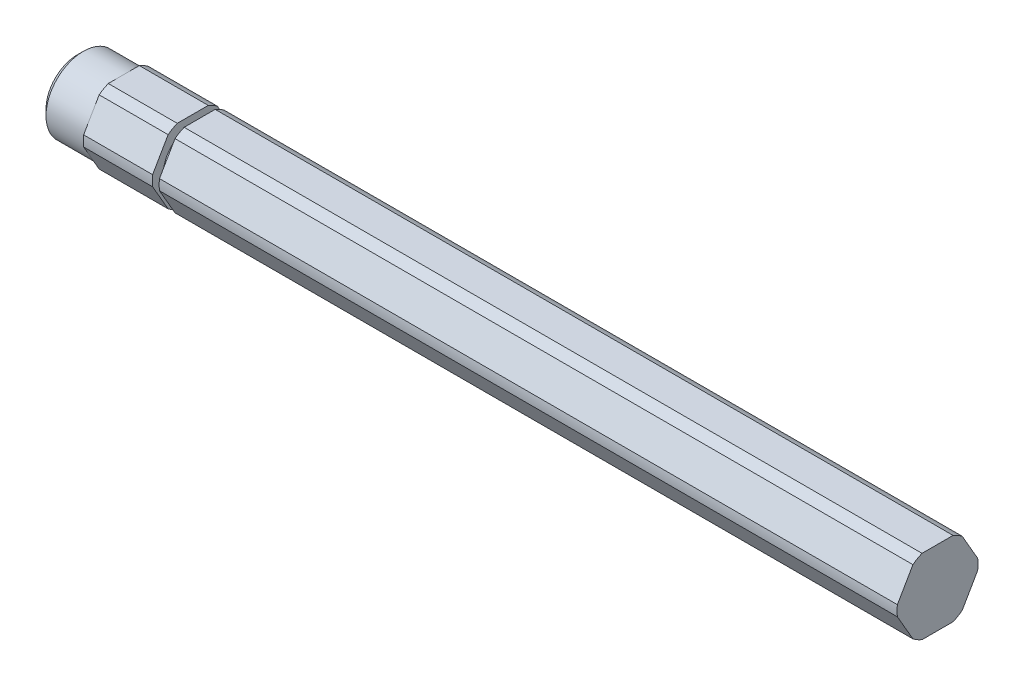
from build123d import *

# Parameters (mm, degrees)
BOSS_EXTRUDE1_DEPTH = 73.025
CUT_EXTRUDE1_START  = -7.8867
SKETCH2_R           = 6.3373
CUT_EXTRUDE1_DEPTH  = 7.8867
CUT_EXTRUDE2_START  = -1.1684
SKETCH3_R           = 5.0292
CUT_EXTRUDE2_DEPTH  = 1.1684
SKETCH4_R           = 3.175
CUT_EXTRUDE3_DEPTH  = 9.02462
CHAMFER1_SIZE       = 1.016


with BuildPart() as part:
    # Sketch1 → Boss-Extrude1 (new, symmetric)
    with BuildSketch(Plane(origin=(0, 0, 0), x_dir=(0, 0, -1), z_dir=(1, 0, 0))):
        with BuildLine():
            Line((2.634981025, 6.35), (-2.634981025, 6.35))
            ThreePointArc((-2.634981025, 6.35), (-3.4375, 5.953924651), (-4.181770802, 5.456960506))
            Line((-4.181770802, 5.456960506), (-6.816751826, 0.893039494))
            ThreePointArc((-6.816751826, 0.893039494), (-6.875, 0), (-6.816751826, -0.893039494))
            Line((-6.816751826, -0.893039494), (-4.181770802, -5.456960506))
            ThreePointArc((-4.181770802, -5.456960506), (-3.4375, -5.953924651), (-2.634981025, -6.35))
            Line((-2.634981025, -6.35), (2.634981025, -6.35))
            ThreePointArc((2.634981025, -6.35), (3.4375, -5.953924651), (4.181770802, -5.456960506))
            Line((4.181770802, -5.456960506), (6.816751826, -0.893039494))
            ThreePointArc((6.816751826, -0.893039494), (6.875, 0), (6.816751826, 0.893039494))
            Line((6.816751826, 0.893039494), (4.181770802, 5.456960506))
            ThreePointArc((4.181770802, 5.456960506), (3.4375, 5.953924651), (2.634981025, 6.35))
        make_face()
    extrude(amount=BOSS_EXTRUDE1_DEPTH, both=True)

    # Sketch2 → Cut-Extrude1 (cut)
    with BuildSketch(Plane.ZY.offset(73.025).offset(CUT_EXTRUDE1_START)):
        with BuildLine():
            Line((-4.181770802, 5.456960506), (-6.816751826, 0.893039494))
            ThreePointArc((-6.816751826, 0.893039494), (-6.875, 0), (-6.816751826, -0.893039494))
            Line((-6.816751826, -0.893039494), (-4.181770802, -5.456960506))
            ThreePointArc((-4.181770802, -5.456960506), (-3.4375, -5.953924651), (-2.634981025, -6.35))
            Line((-2.634981025, -6.35), (2.634981025, -6.35))
            ThreePointArc((2.634981025, -6.35), (3.4375, -5.953924651), (4.181770802, -5.456960506))
            Line((4.181770802, -5.456960506), (6.816751826, -0.893039494))
            ThreePointArc((6.816751826, -0.893039494), (6.875, 0), (6.816751826, 0.893039494))
            Line((6.816751826, 0.893039494), (4.181770802, 5.456960506))
            ThreePointArc((4.181770802, 5.456960506), (3.4375, 5.953924651), (2.634981025, 6.35))
            Line((2.634981025, 6.35), (-2.634981025, 6.35))
            ThreePointArc((-2.634981025, 6.35), (-3.4375, 5.953924651), (-4.181770802, 5.456960506))
        make_face()
        Circle(SKETCH2_R, mode=Mode.SUBTRACT)
    extrude(amount=CUT_EXTRUDE1_DEPTH, mode=Mode.SUBTRACT)

    # Sketch3 → Cut-Extrude2 (cut)
    with BuildSketch(Plane.ZY.offset(53.4289).offset(CUT_EXTRUDE2_START)):
        with BuildLine():
            Line((-4.181770802, 5.456960506), (-6.816751826, 0.893039494))
            ThreePointArc((-6.816751826, 0.893039494), (-6.875, 0), (-6.816751826, -0.893039494))
            Line((-6.816751826, -0.893039494), (-4.181770802, -5.456960506))
            ThreePointArc((-4.181770802, -5.456960506), (-3.4375, -5.953924651), (-2.634981025, -6.35))
            Line((-2.634981025, -6.35), (2.634981025, -6.35))
            ThreePointArc((2.634981025, -6.35), (3.4375, -5.953924651), (4.181770802, -5.456960506))
            Line((4.181770802, -5.456960506), (6.816751826, -0.893039494))
            ThreePointArc((6.816751826, -0.893039494), (6.875, 0), (6.816751826, 0.893039494))
            Line((6.816751826, 0.893039494), (4.181770802, 5.456960506))
            ThreePointArc((4.181770802, 5.456960506), (3.4375, 5.953924651), (2.634981025, 6.35))
            Line((2.634981025, 6.35), (-2.634981025, 6.35))
            ThreePointArc((-2.634981025, 6.35), (-3.4375, 5.953924651), (-4.181770802, 5.456960506))
        make_face()
        Circle(SKETCH3_R, mode=Mode.SUBTRACT)
    extrude(amount=CUT_EXTRUDE2_DEPTH, mode=Mode.SUBTRACT)

    # Sketch4 → Cut-Extrude3 (cut)
    with BuildSketch(Plane.ZY.offset(73.025)):
        Circle(SKETCH4_R)
    extrude(amount=-CUT_EXTRUDE3_DEPTH, mode=Mode.SUBTRACT)

    # Sketch6 → Cut-Revolve1 (revolve, cut)
    with BuildSketch(Plane.XY, mode=Mode.PRIVATE) as cut_revolve1_sk:
        Polygon((-62.09538, 0), (-64.00038, 0), (-64.00038, 3.175), align=None)
    revolve(cut_revolve1_sk.sketch.rotate(Axis((-62.09538, 0, 0), (-1, 0, 0)), 180), axis=Axis((-62.09538, 0, 0), (-1, 0, 0)), mode=Mode.SUBTRACT)

    # Chamfer1
    chamfer1_edges = [part.edges().sort_by_distance(p)[0] for p in [
        (-73.025, 0, -6.3373),
    ]]
    chamfer(chamfer1_edges, length=CHAMFER1_SIZE)


solid = part.part
